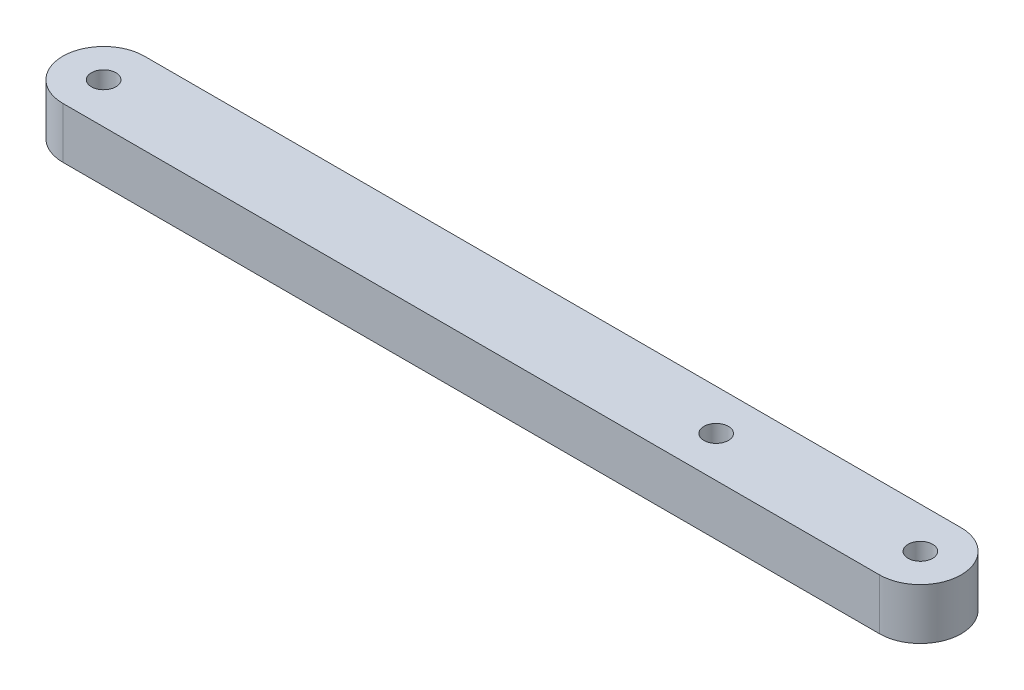
from build123d import *

# Parameters (mm, degrees)
SKETCH1_R           = 6
BOSS_EXTRUDE1_DEPTH = 25


with BuildPart() as part:
    # Sketch1 → Boss-Extrude1 (new body)
    with BuildSketch(Plane(origin=(0, 0, 0), x_dir=(1, 0, 0), z_dir=(0, 1, 0))):
        with BuildLine():
            Line((0, 20), (400, 20))
            ThreePointArc((400, 20), (420, 0), (400, -20))
            Line((400, -20), (0, -20))
            ThreePointArc((0, -20), (-20, 0), (0, 20))
        make_face()
        with Locations(Location((300, 0, 0), (0, 0, 270))):
            Circle(SKETCH1_R, mode=Mode.SUBTRACT)
        with Locations(Location((400, 0, 0), (0, 0, 270))):
            Circle(SKETCH1_R, mode=Mode.SUBTRACT)
        with Locations(Location((0, 0, 0), (0, 0, 270))):
            Circle(SKETCH1_R, mode=Mode.SUBTRACT)
    extrude(amount=BOSS_EXTRUDE1_DEPTH)


solid = part.part
